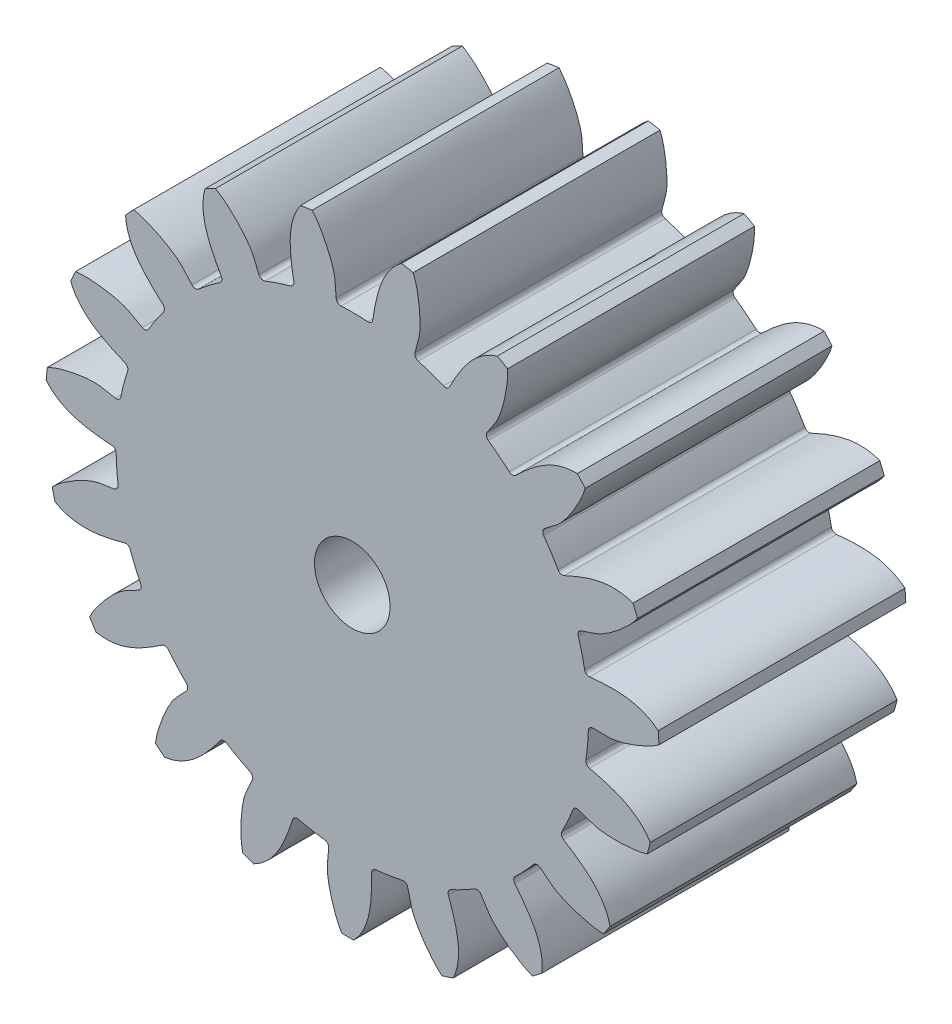
from build123d import *

# Parameters (mm, degrees)
SKETCH_3_R               = 13
SKETCH_3_R_2             = 10
EXTRUDE_1_DEPTH          = 4
CUT_EXTRUDE_2_DEPTH      = 19.814887722
PATTERN_CIRCULAR_4_COUNT = 19
CUT_EXTRUDE_4_DEPTH      = 19.804447773
CUT_EXTRUDE_4_DEPTH_BACK = 19.804447773
SKETCH_8_R               = 4.05
SKETCH_10_R              = 4.5
CUT_EXTRUDE_5_DEPTH      = 0.6
CUT_EXTRUDE_START        = -0.6
SKETCH_11_R              = 4.5
CUT_EXTRUDE_6_DEPTH      = 0.6
EXTRUDE_START            = 6.45
EXTRUDE_4_DEPTH          = 6.45
CUT_EXTRUDE_7_DEPTH      = 20.473308824
CUT_EXTRUDE_7_DEPTH_BACK = 20.473308824
SKETCH_14_R              = 1.6


with BuildPart() as part:
    # 草图3 → 凸台-拉伸1 (new body)
    # profile 1 of 2: a face of its own
    with BuildSketch(Plane.XY):
        Circle(SKETCH_3_R)
        Circle(SKETCH_3_R_2, mode=Mode.SUBTRACT)
    # profile 2 of 2: a face of its own
    with BuildSketch(Plane.XY):
        Circle(SKETCH_3_R_2)
    extrude(amount=EXTRUDE_1_DEPTH)

    # 草图6 → 切除-拉伸2 (cut, symmetric)
    with BuildSketch(Plane.XY.offset(4)):
        with BuildLine():
            Line((-1.696840499, 12.888783198), (-1.873622587, 14.231576474))
            Line((-1.873622587, 14.231576474), (3.000861464, 14.403965519))
            Line((3.000861464, 14.403965519), (2.084995297, 12.83171051))
            add(Edge.make_bspline(
                [(2.084995297, 12.83171051), (1.471750903, 12.385409064), (1.073531879, 11.424223458), (0.908091171, 10.424013275), (0.866775265, 10.148389403)],
                knots=[0, 0, 0, 0, 0.67611985, 0.94077492, 0.94077492, 0.94077492, 0.94077492], degree=3))
            ThreePointArc((0.866775265, 10.148389403), (0.794461275, 10.022295574), (0.655867727, 9.978468696))
            ThreePointArc((0.655867727, 9.978468696), (0.089873577, 9.999596129), (-0.476408885, 9.988645282))
            ThreePointArc((-0.476408885, 9.988645282), (-0.618800498, 10.03892803), (-0.685447576, 10.174434093))
            add(Edge.make_bspline(
                [(-1.696840499, 12.888783198), (-1.34037548, 12.491366053), (-0.721854022, 11.223575025), (-0.721476087, 10.688451407), (-0.685447576, 10.174434093)],
                knots=[0, 0, 0, 0, 0.6442443, 0.94077492, 0.94077492, 0.94077492, 0.94077492], degree=3))
        make_face()
    cut_extrude_2 = extrude(amount=CUT_EXTRUDE_2_DEPTH, both=True, mode=Mode.SUBTRACT)

    # 阵列(圆周)4: 切除-拉伸2 ×19 about axis
    pattern_circular_4_axis = Axis((0, 0, 4), (0, 0, 1))
    for i in range(1, PATTERN_CIRCULAR_4_COUNT):
        add(cut_extrude_2.rotate(pattern_circular_4_axis, i * 360 / PATTERN_CIRCULAR_4_COUNT), mode=Mode.SUBTRACT)

    # 草图8 → 切除-拉伸4 (cut, two sides: drawn at the far end of the back side and taken through both)
    with BuildSketch(Plane(origin=(0, 0, 0), x_dir=(-1, 0, 0), z_dir=(0, 0, -1)).offset(-CUT_EXTRUDE_4_DEPTH_BACK)):
        Circle(SKETCH_8_R)
    extrude(amount=CUT_EXTRUDE_4_DEPTH + CUT_EXTRUDE_4_DEPTH_BACK, mode=Mode.SUBTRACT)

    # 草图10 → 切除-拉伸5 (cut)
    with BuildSketch(Plane(origin=(0, 0, 0), x_dir=(-1, 0, 0), z_dir=(0, 0, -1))):
        Circle(SKETCH_10_R)
    extrude(amount=-CUT_EXTRUDE_5_DEPTH, mode=Mode.SUBTRACT)

    # 草图11 → 切除-拉伸6 (cut)
    with BuildSketch(Plane.XY.offset(4).offset(CUT_EXTRUDE_START)):
        with Locations(Location((0, 0, 0), (0, 0, 180))):
            Circle(SKETCH_11_R)
    extrude(amount=CUT_EXTRUDE_6_DEPTH, mode=Mode.SUBTRACT)

    # 草图13 → 凸台-拉伸4 (add)
    with BuildSketch(Plane.XY.offset(4).offset(EXTRUDE_START)):
        with BuildLine():
            ThreePointArc((10.631824778, -7.480929213), (10.774633528, -7.27373854), (10.913405149, -7.063822482))
            add(Edge.make_bspline(
                [(10.913405149, -7.063822482), (10.751031656, -6.322952374), (10.030766276, -5.572170153), (9.181257245, -5.018884111), (8.945444665, -4.870331258)],
                knots=[0, 0, 0, 0, 0.67611985, 0.94077492, 0.94077492, 0.94077492, 0.94077492], degree=3))
            ThreePointArc((8.945444665, -4.870331258), (8.8590195, -4.753456721), (8.874556408, -4.608931391))
            ThreePointArc((8.874556408, -4.608931391), (9.121261608, -4.099095838), (9.338706188, -3.576110559))
            ThreePointArc((9.338706188, -3.576110559), (9.441951847, -3.465910467), (9.592816512, -3.459309017))
            add(Edge.make_bspline(
                [(9.592816512, -3.459309017), (10.078012345, -3.63279347), (10.568216095, -3.847404077), (11.977682543, -3.790244479), (12.48481693, -3.623443971)],
                knots=[0, 0, 0, 0, 0.29653062, 0.94077492, 0.94077492, 0.94077492, 0.94077492], degree=3))
            ThreePointArc((12.48481693, -3.623443971), (12.552613207, -3.381109535), (12.615706166, -3.137508236))
            add(Edge.make_bspline(
                [(12.615706166, -3.137508236), (12.221570386, -2.489503102), (11.296552383, -2.013270119), (10.31342041, -1.765797772), (10.042149774, -1.701862142)],
                knots=[0, 0, 0, 0, 0.67611985, 0.94077492, 0.94077492, 0.94077492, 0.94077492], degree=3))
            ThreePointArc((10.042149774, -1.701862142), (9.922458262, -1.619382395), (9.890226039, -1.47764302))
            ThreePointArc((9.890226039, -1.47764302), (9.958020737, -0.915326716), (9.993870528, -0.350074083))
            ThreePointArc((9.993870528, -0.350074083), (10.055740141, -0.212321125), (10.196287055, -0.157091683))
            add(Edge.make_bspline(
                [(10.196287055, -0.157091683), (10.711523949, -0.16363344), (11.244851058, -0.207446955), (12.559389035, 0.304268585), (12.984885446, 0.626697648)],
                knots=[0, 0, 0, 0, 0.29653062, 0.94077492, 0.94077492, 0.94077492, 0.94077492], degree=3))
            ThreePointArc((12.984885446, 0.626697648), (12.97032247, 0.877915151), (12.950899667, 1.12880371))
            add(Edge.make_bspline(
                [(12.950899667, 1.12880371), (12.367712328, 1.61372246), (11.338181754, 1.763798972), (10.327964444, 1.678640154), (10.050632134, 1.651030144)],
                knots=[0, 0, 0, 0, 0.67611985, 0.94077492, 0.94077492, 0.94077492, 0.94077492], degree=3))
            ThreePointArc((10.050632134, 1.651030144), (9.910644708, 1.69017714), (9.834136216, 1.8137709))
            ThreePointArc((9.834136216, 1.8137709), (9.715673805, 2.367632258), (9.566043926, 2.913898353))
            ThreePointArc((9.566043926, 2.913898353), (9.57983296, 3.064276505), (9.694831684, 3.162148972))
            add(Edge.make_bspline(
                [(9.694831684, 3.162148972), (10.184275727, 3.323258811), (10.702931927, 3.454990263), (11.780090846, 4.365809427), (12.077840143, 4.808926853)],
                knots=[0, 0, 0, 0, 0.29653062, 0.94077492, 0.94077492, 0.94077492, 0.94077492], degree=3))
            ThreePointArc((12.077840143, 4.808926853), (11.982496039, 5.041804108), (11.882662235, 5.272792259))
            add(Edge.make_bspline(
                [(11.882662235, 5.272792259), (11.173620733, 5.542076154), (10.151143203, 5.349733076), (9.223313276, 4.941171373), (8.969972551, 4.825007696)],
                knots=[0, 0, 0, 0, 0.67611985, 0.94077492, 0.94077492, 0.94077492, 0.94077492], degree=3))
            ThreePointArc((8.969972551, 4.825007696), (8.824859021, 4.816579757), (8.712365142, 4.908634599))
            ThreePointArc((8.712365142, 4.908634599), (8.420482862, 5.394021539), (8.101588032, 5.862104687))
            ThreePointArc((8.101588032, 5.862104687), (8.065802231, 6.008812229), (8.142790869, 6.138721721))
            add(Edge.make_bspline(
                [(8.142790869, 6.138721721), (8.553403205, 6.450024405), (9.001184049, 6.743025677), (9.724237028, 7.954247075), (9.861973453, 8.470034215)],
                knots=[0, 0, 0, 0, 0.29653062, 0.94077492, 0.94077492, 0.94077492, 0.94077492], degree=3))
            ThreePointArc((9.861973453, 8.470034215), (9.696180235, 8.659335359), (9.526753972, 8.845391951))
            add(Edge.make_bspline(
                [(9.526753972, 8.845391951), (8.768693956, 8.869859903), (7.864070774, 8.355940591), (7.119173, 7.668250004), (6.917277258, 7.476120796)],
                knots=[0, 0, 0, 0, 0.67611985, 0.94077492, 0.94077492, 0.94077492, 0.94077492], degree=3))
            ThreePointArc((6.917277258, 7.476120796), (6.782762927, 7.42103122), (6.646474119, 7.471571574))
            ThreePointArc((6.646474119, 7.471571574), (6.212801944, 7.83588489), (5.759199365, 8.17506102))
            ThreePointArc((5.759199365, 8.17506102), (5.677716677, 8.302199912), (5.708352315, 8.450068718))
            add(Edge.make_bspline(
                [(5.708352315, 8.450068718), (5.995636726, 8.877829772), (6.324018211, 9.300349629), (6.61461124, 10.68071863), (6.577408916, 11.213281944)],
                knots=[0, 0, 0, 0, 0.29653062, 0.94077492, 0.94077492, 0.94077492, 0.94077492], degree=3))
            ThreePointArc((6.577408916, 11.213281944), (6.35913285, 11.338493259), (6.138474093, 11.459456174))
            add(Edge.make_bspline(
                [(6.138474093, 11.459456174), (5.413543129, 11.236456701), (4.724804254, 10.456652288), (4.243559864, 9.564354762), (4.114987643, 9.317080204)],
                knots=[0, 0, 0, 0, 0.67611985, 0.94077492, 0.94077492, 0.94077492, 0.94077492], degree=3))
            ThreePointArc((4.114987643, 9.317080204), (4.005649225, 9.221298802), (3.860334494, 9.224847836))
            ThreePointArc((3.860334494, 9.224847836), (3.331867534, 9.428608526), (2.792712084, 9.602122641))
            ThreePointArc((2.792712084, 9.602122641), (2.674362422, 9.695915412), (2.655325214, 9.845719654))
            add(Edge.make_bspline(
                [(2.655325214, 9.845719654), (2.788149975, 10.34358453), (2.961546873, 10.84983639), (2.788189688, 12.249768592), (2.580080063, 12.741396582)],
                knots=[0, 0, 0, 0, 0.29653062, 0.94077492, 0.94077492, 0.94077492, 0.94077492], degree=3))
            ThreePointArc((2.580080063, 12.741396582), (2.332974749, 12.788949481), (2.084995297, 12.83171051))
            add(Edge.make_bspline(
                [(2.084995297, 12.83171051), (1.471750903, 12.385409064), (1.073531879, 11.424223458), (0.908091171, 10.424013275), (0.866775265, 10.148389403)],
                knots=[0, 0, 0, 0, 0.67611985, 0.94077492, 0.94077492, 0.94077492, 0.94077492], degree=3))
            ThreePointArc((0.866775265, 10.148389403), (0.794461275, 10.022295574), (0.655867727, 9.978468696))
            ThreePointArc((0.655867727, 9.978468696), (0.089873577, 9.999596129), (-0.476408885, 9.988645282))
            ThreePointArc((-0.476408885, 9.988645282), (-0.618800498, 10.03892803), (-0.685447576, 10.174434093))
            add(Edge.make_bspline(
                [(-0.685447576, 10.174434093), (-0.721476087, 10.688451407), (-0.721854022, 11.223575025), (-1.34037548, 12.491366053), (-1.696840499, 12.888783198)],
                knots=[0, 0, 0, 0, 0.29653062, 0.94077492, 0.94077492, 0.94077492, 0.94077492], degree=3))
            ThreePointArc((-1.696840499, 12.888783198), (-1.945997366, 12.853524585), (-2.194425091, 12.813449907))
            add(Edge.make_bspline(
                [(-2.194425091, 12.813449907), (-2.629528369, 12.192210175), (-2.694074332, 11.153802751), (-2.525783291, 10.154068204), (-2.475365662, 9.879963141)],
                knots=[0, 0, 0, 0, 0.67611985, 0.94077492, 0.94077492, 0.94077492, 0.94077492], degree=3))
            ThreePointArc((-2.475365662, 9.879963141), (-2.502818882, 9.73722111), (-2.619672484, 9.650767642))
            ThreePointArc((-2.619672484, 9.650767642), (-3.161859577, 9.486972331), (-3.693903558, 9.292743217))
            ThreePointArc((-3.693903558, 9.292743217), (-3.844906783, 9.294067025), (-3.951941485, 9.400590726))
            add(Edge.make_bspline(
                [(-3.951941485, 9.400590726), (-4.152919021, 9.875058725), (-4.327030833, 10.381065154), (-5.323690166, 11.379330179), (-5.789882063, 11.639470164)],
                knots=[0, 0, 0, 0, 0.29653062, 0.94077492, 0.94077492, 0.94077492, 0.94077492], degree=3))
            ThreePointArc((-5.789882063, 11.639470164), (-6.014090471, 11.525220857), (-6.23604547, 11.406653186))
            add(Edge.make_bspline(
                [(-6.23604547, 11.406653186), (-6.445857441, 10.677796132), (-6.169735786, 9.674694447), (-5.685949941, 8.783772287), (-5.54926231, 8.540889569)],
                knots=[0, 0, 0, 0, 0.67611985, 0.94077492, 0.94077492, 0.94077492, 0.94077492], degree=3))
            ThreePointArc((-5.54926231, 8.540889569), (-5.528879777, 8.39696765), (-5.611330534, 8.277256166))
            ThreePointArc((-5.611330534, 8.277256166), (-6.070956184, 7.946287876), (-6.511106465, 7.589828233))
            ThreePointArc((-6.511106465, 7.589828233), (-6.654357758, 7.542049646), (-6.790181214, 7.608047488))
            add(Edge.make_bspline(
                [(-6.790181214, 7.608047488), (-7.13432874, 7.991550203), (-7.463306713, 8.413605795), (-8.730100418, 9.034167311), (-9.255500067, 9.128839932)],
                knots=[0, 0, 0, 0, 0.29653062, 0.94077492, 0.94077492, 0.94077492, 0.94077492], degree=3))
            ThreePointArc((-9.255500067, 9.128839932), (-9.430463555, 8.947980617), (-9.60189356, 8.763768599))
            add(Edge.make_bspline(
                [(-9.60189356, 8.763768599), (-9.563677842, 8.006277195), (-8.976810635, 7.147182881), (-8.229955689, 6.461618348), (-8.021810282, 6.276278088)],
                knots=[0, 0, 0, 0, 0.67611985, 0.94077492, 0.94077492, 0.94077492, 0.94077492], degree=3))
            ThreePointArc((-8.021810282, 6.276278088), (-7.955800759, 6.146772452), (-7.994913852, 6.00677555))
            ThreePointArc((-7.994913852, 6.00677555), (-8.322170488, 5.54449983), (-8.622729956, 5.064437591))
            ThreePointArc((-8.622729956, 5.064437591), (-8.742705817, 4.972734162), (-8.892599447, 4.991054254))
            add(Edge.make_bspline(
                [(-8.892599447, 4.991054254), (-9.342623239, 5.242033215), (-9.790817505, 5.534401698), (-11.190468827, 5.710012235), (-11.718141024, 5.628958246)],
                knots=[0, 0, 0, 0, 0.29653062, 0.94077492, 0.94077492, 0.94077492, 0.94077492], degree=3))
            ThreePointArc((-11.718141024, 5.628958246), (-11.824899585, 5.401087836), (-11.927227495, 5.171193701))
            add(Edge.make_bspline(
                [(-11.927227495, 5.171193701), (-11.645125353, 4.467153894), (-10.811108762, 3.84516315), (-9.882118037, 3.439247799), (-9.625070638, 3.331534489)],
                knots=[0, 0, 0, 0, 0.67611985, 0.94077492, 0.94077492, 0.94077492, 0.94077492], degree=3))
            ThreePointArc((-9.625070638, 3.331534489), (-9.520587282, 3.230479082), (-9.512124199, 3.085367598))
            ThreePointArc((-9.512124199, 3.085367598), (-9.671548488, 2.541879196), (-9.79994686, 1.990236553))
            ThreePointArc((-9.79994686, 1.990236553), (-9.883646043, 1.86454577), (-10.031366548, 1.833202847))
            add(Edge.make_bspline(
                [(-10.031366548, 1.833202847), (-10.538499545, 1.924460589), (-11.0573413, 2.055459301), (-12.438176302, 1.767088734), (-12.910939576, 1.519091591)],
                knots=[0, 0, 0, 0, 0.29653062, 0.94077492, 0.94077492, 0.94077492, 0.94077492], degree=3))
            ThreePointArc((-12.910939576, 1.519091591), (-12.937924262, 1.26890338), (-12.96006126, 1.018239726))
            add(Edge.make_bspline(
                [(-12.96006126, 1.018239726), (-12.464642839, 0.443945154), (-11.473855503, 0.126460328), (-10.463399559, 0.044181386), (-10.185305242, 0.025767433)],
                knots=[0, 0, 0, 0, 0.67611985, 0.94077492, 0.94077492, 0.94077492, 0.94077492], degree=3))
            ThreePointArc((-10.185305242, 0.025767433), (-10.053670446, -0.035886822), (-9.998548294, -0.170387807))
            ThreePointArc((-9.998548294, -0.170387807), (-9.972864139, -0.736193491), (-9.915187461, -1.299637496))
            ThreePointArc((-9.915187461, -1.299637496), (-9.953539861, -1.445695087), (-10.08307943, -1.523304533))
            add(Edge.make_bspline(
                [(-10.08307943, -1.523304533), (-10.592365903, -1.601657202), (-11.125630593, -1.646224004), (-12.338014375, -2.367326251), (-12.704637491, -2.755392209)],
                knots=[0, 0, 0, 0, 0.29653062, 0.94077492, 0.94077492, 0.94077492, 0.94077492], degree=3))
            ThreePointArc((-12.704637491, -2.755392209), (-12.648924093, -3.000786445), (-12.588471292, -3.245056323))
            add(Edge.make_bspline(
                [(-12.588471292, -3.245056323), (-11.933422864, -3.627371933), (-10.893231964, -3.605946433), (-9.910809382, -3.355672766), (-9.641803982, -3.282791923)],
                knots=[0, 0, 0, 0, 0.67611985, 0.94077492, 0.94077492, 0.94077492, 0.94077492], degree=3))
            ThreePointArc((-9.641803982, -3.282791923), (-9.497282418, -3.298363832), (-9.401474538, -3.40767905))
            ThreePointArc((-9.401474538, -3.40767905), (-9.193465217, -3.934488189), (-8.95596365, -4.448675658))
            ThreePointArc((-8.95596365, -4.448675658), (-8.944813189, -4.599272449), (-9.042134201, -4.714738231))
            add(Edge.make_bspline(
                [(-9.042134201, -4.714738231), (-9.498385058, -4.954210583), (-9.988285179, -5.169513395), (-10.900837147, -6.245204703), (-11.121590801, -6.731286508)],
                knots=[0, 0, 0, 0, 0.29653062, 0.94077492, 0.94077492, 0.94077492, 0.94077492], degree=3))
            ThreePointArc((-11.121590801, -6.731286508), (-10.98921673, -6.945294498), (-10.852725129, -7.156700167))
            add(Edge.make_bspline(
                [(-10.852725129, -7.156700167), (-10.109031356, -7.305606986), (-9.132157717, -6.947592946), (-8.284229227, -6.391887706), (-8.053463652, -6.235609836)],
                knots=[0, 0, 0, 0, 0.67611985, 0.94077492, 0.94077492, 0.94077492, 0.94077492], degree=3))
            ThreePointArc((-8.053463652, -6.235609836), (-7.911716475, -6.203411942), (-7.785605137, -6.275695392))
            ThreePointArc((-7.785605137, -6.275695392), (-7.417811686, -6.706420043), (-7.026222211, -7.115630783))
            ThreePointArc((-7.026222211, -7.115630783), (-6.966777215, -7.254447276), (-7.021333428, -7.395256884))
            add(Edge.make_bspline(
                [(-7.021333428, -7.395256884), (-7.37510681, -7.769898375), (-7.768554082, -8.132605796), (-8.282385071, -9.446318322), (-8.333347178, -9.977741468)],
                knots=[0, 0, 0, 0, 0.29653062, 0.94077492, 0.94077492, 0.94077492, 0.94077492], degree=3))
            ThreePointArc((-8.333347178, -9.977741468), (-8.138657219, -10.137172124), (-7.940917801, -10.2928045))
            add(Edge.make_bspline(
                [(-7.940917801, -10.2928045), (-7.189169443, -10.192166164), (-6.381472481, -9.53635996), (-5.759924291, -8.735442432), (-5.592405573, -8.512702669)],
                knots=[0, 0, 0, 0, 0.67611985, 0.94077492, 0.94077492, 0.94077492, 0.94077492], degree=3))
            ThreePointArc((-5.592405573, -8.512702669), (-5.468793288, -8.436224112), (-5.326044613, -8.463642761))
            ThreePointArc((-5.326044613, -8.463642761), (-4.838323161, -8.751607223), (-4.335080573, -9.011496903))
            ThreePointArc((-4.335080573, -9.011496903), (-4.233782829, -9.123490176), (-4.239662231, -9.274384705))
            add(Edge.make_bspline(
                [(-4.239662231, -9.274384705), (-4.452621302, -9.743597116), (-4.706979609, -10.214404169), (-4.766408057, -11.623776776), (-4.642056084, -12.142953319)],
                knots=[0, 0, 0, 0, 0.29653062, 0.94077492, 0.94077492, 0.94077492, 0.94077492], degree=3))
            ThreePointArc((-4.642056084, -12.142953319), (-4.406147914, -12.230529856), (-4.168588813, -12.313523757))
            add(Edge.make_bspline(
                [(-4.168588813, -12.313523757), (-3.490249469, -11.97424599), (-2.939255683, -11.0917144), (-2.611442185, -10.132376426), (-2.525323576, -9.867312079)],
                knots=[0, 0, 0, 0, 0.67611985, 0.94077492, 0.94077492, 0.94077492, 0.94077492], degree=3))
            ThreePointArc((-2.525323576, -9.867312079), (-2.433241492, -9.754840498), (-2.289324513, -9.734423109))
            ThreePointArc((-2.289324513, -9.734423109), (-1.734527246, -9.848421967), (-1.174165689, -9.930827505))
            ThreePointArc((-1.174165689, -9.930827505), (-1.04199238, -10.00386135), (-0.998557846, -10.148489036))
            add(Edge.make_bspline(
                [(-0.998557846, -10.148489036), (-1.047625186, -10.661425922), (-1.135330859, -11.189313357), (-0.733916772, -12.541618654), (-0.447726184, -12.992287761)],
                knots=[0, 0, 0, 0, 0.29653062, 0.94077492, 0.94077492, 0.94077492, 0.94077492], degree=3))
            ThreePointArc((-0.447726184, -12.992287761), (-0.196164114, -12.998519902), (0.055471455, -12.99988165))
            add(Edge.make_bspline(
                [(0.055471455, -12.99988165), (0.586893191, -12.458730464), (0.821475076, -11.44510948), (0.820030203, -10.431310214), (0.815416416, -10.152645118)],
                knots=[0, 0, 0, 0, 0.67611985, 0.94077492, 0.94077492, 0.94077492, 0.94077492], degree=3))
            ThreePointArc((0.815416416, -10.152645118), (0.865989775, -10.016368554), (0.99547942, -9.950327669))
            ThreePointArc((0.99547942, -9.950327669), (1.55723161, -9.878007376), (2.113988266, -9.773998855))
            ThreePointArc((2.113988266, -9.773998855), (2.262714112, -9.800158922), (2.350755776, -9.922847111))
            add(Edge.make_bspline(
                [(2.350755776, -9.922847111), (2.470897374, -10.4239238), (2.559348607, -10.951686823), (3.378105783, -12.100381549), (3.795121796, -12.433706228)],
                knots=[0, 0, 0, 0, 0.29653062, 0.94077492, 0.94077492, 0.94077492, 0.94077492], degree=3))
            ThreePointArc((3.795121796, -12.433706228), (4.035077111, -12.357918624), (4.27352053, -12.277500653))
            add(Edge.make_bspline(
                [(4.27352053, -12.277500653), (4.600436868, -11.593118175), (4.493186263, -10.558249358), (4.162639595, -9.599849683), (4.067793386, -9.337781524)],
                knots=[0, 0, 0, 0, 0.67611985, 0.94077492, 0.94077492, 0.94077492, 0.94077492], degree=3))
            ThreePointArc((4.067793386, -9.337781524), (4.071377613, -9.192467657), (4.172407712, -9.087959831))
            ThreePointArc((4.172407712, -9.087959831), (4.680240257, -8.837157412), (5.173058791, -8.558005769))
            ThreePointArc((5.173058791, -8.558005769), (5.32222042, -8.534457208), (5.445328533, -8.621910731))
            add(Edge.make_bspline(
                [(5.445328533, -8.621910731), (5.721659864, -9.05682779), (5.976682938, -9.527275089), (7.12405816, -10.347880345), (7.626709441, -10.527739696)],
                knots=[0, 0, 0, 0, 0.29653062, 0.94077492, 0.94077492, 0.94077492, 0.94077492], degree=3))
            ThreePointArc((7.626709441, -10.527739696), (7.829055121, -10.37814511), (8.028467345, -10.224661955))
            add(Edge.make_bspline(
                [(8.028467345, -10.224661955), (8.115451827, -9.471211646), (7.677991, -8.52723909), (7.054162396, -7.728096481), (6.879361825, -7.511024412)],
                knots=[0, 0, 0, 0, 0.67611985, 0.94077492, 0.94077492, 0.94077492, 0.94077492], degree=3))
            ThreePointArc((6.879361825, -7.511024412), (6.835568513, -7.372420254), (6.897190887, -7.24077053))
            ThreePointArc((6.897190887, -7.24077053), (7.296072252, -6.838664321), (7.671548128, -6.414619967))
            ThreePointArc((7.671548128, -6.414619967), (7.804981563, -6.343914631), (7.949815452, -6.386656542))
            add(Edge.make_bspline(
                [(7.949815452, -6.386656542), (8.352391726, -6.708283958), (8.746350935, -7.070435268), (10.098008294, -7.474025743), (10.631824778, -7.480929213)],
                knots=[0, 0, 0, 0, 0.29653062, 0.94077492, 0.94077492, 0.94077492, 0.94077492], degree=3))
        make_face()
    extrude(amount=-EXTRUDE_4_DEPTH)

    # 草图14 → 切除-拉伸7 (cut, two sides: drawn at the far end of the back side and taken through both)
    with BuildSketch(Plane(origin=(0, 0, 4), x_dir=(-1, 0, 0), z_dir=(0, 0, -1)).offset(-CUT_EXTRUDE_7_DEPTH_BACK)):
        Circle(SKETCH_14_R)
    extrude(amount=CUT_EXTRUDE_7_DEPTH + CUT_EXTRUDE_7_DEPTH_BACK, mode=Mode.SUBTRACT)


solid = part.part
